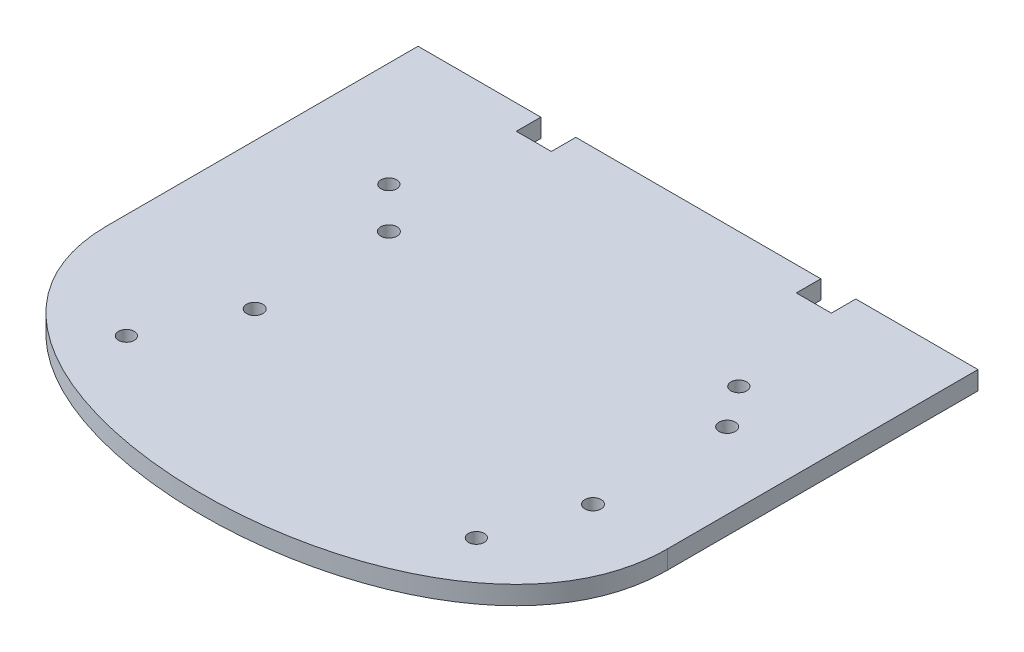
from build123d import *

# Parameters (mm, degrees)
BOSS_EXTRUDE1_DEPTH     = 3.175
CUT_EXTRUDE1_DEPTH      = 65.189801711
CUT_EXTRUDE1_DEPTH_BACK = 65.189801711
SKETCH3_R               = 1.35
SKETCH3_R_2             = 1.397
SKETCH5_W               = 6
SKETCH5_H               = 4.2
CUT_EXTRUDE2_DEPTH      = 65.189801711


with BuildPart() as part:
    # Sketch2 → Boss-Extrude1 (new body)
    with BuildSketch(Plane(origin=(0, 0, 0), x_dir=(1, 0, 0), z_dir=(0, 1, 0))):
        with BuildLine():
            Line((48, 42.5), (-48, 42.5))
            Line((-48, 42.5), (-48, -10.75))
            add(Edge.make_bspline(
                [(-48, -10.75), (-48, -53.083333333), (48, -53.083333333), (48, -10.75)],
                knots=[0, 0, 0, 0, 1, 1, 1, 1], degree=3))
            Line((48, -10.75), (48, 42.5))
        make_face()
    extrude(amount=BOSS_EXTRUDE1_DEPTH)

    # Sketch3 → Cut-Extrude1 (cut, two sides: drawn at the far end of the back side and taken through both)
    with BuildSketch(Plane(origin=(0, 3.175, 0), x_dir=(1, 0, 0), z_dir=(0, 1, 0)).offset(-CUT_EXTRUDE1_DEPTH_BACK)):
        with Locations(Location((-30, 19.5, 0), (0, 0, 270))):
            Circle(SKETCH3_R)
        with Locations(Location((-30, -25.5, 0), (0, 0, 270))):
            Circle(SKETCH3_R)
        with Locations(Location((30, -25.5, 0), (0, 0, 90))):
            Circle(SKETCH3_R)
        with Locations(Location((30, 19.5, 0), (0, 0, 90))):
            Circle(SKETCH3_R)
        with Locations(Location((-23, 12.5, 0), (0, 0, 270))):
            Circle(SKETCH3_R_2)
        with Locations(Location((-23, -10.5, 0), (0, 0, 270))):
            Circle(SKETCH3_R_2)
        with Locations(Location((35, -10.5, 0), (0, 0, 90))):
            Circle(SKETCH3_R_2)
        with Locations(Location((35, 12.5, 0), (0, 0, 90))):
            Circle(SKETCH3_R_2)
    extrude(amount=CUT_EXTRUDE1_DEPTH + CUT_EXTRUDE1_DEPTH_BACK, mode=Mode.SUBTRACT)

    # Sketch5 → Cut-Extrude2 (cut, through all)
    with BuildSketch(Plane(origin=(0, 3.175, 0), x_dir=(1, 0, 0), z_dir=(0, 1, 0))):
        with Locations((24.051144599, 40.4)):
            Rectangle(SKETCH5_W, SKETCH5_H)
        with Locations((-23.948855401, 40.4)):
            Rectangle(SKETCH5_W, SKETCH5_H)
    extrude(amount=-CUT_EXTRUDE2_DEPTH, mode=Mode.SUBTRACT)


solid = part.part
